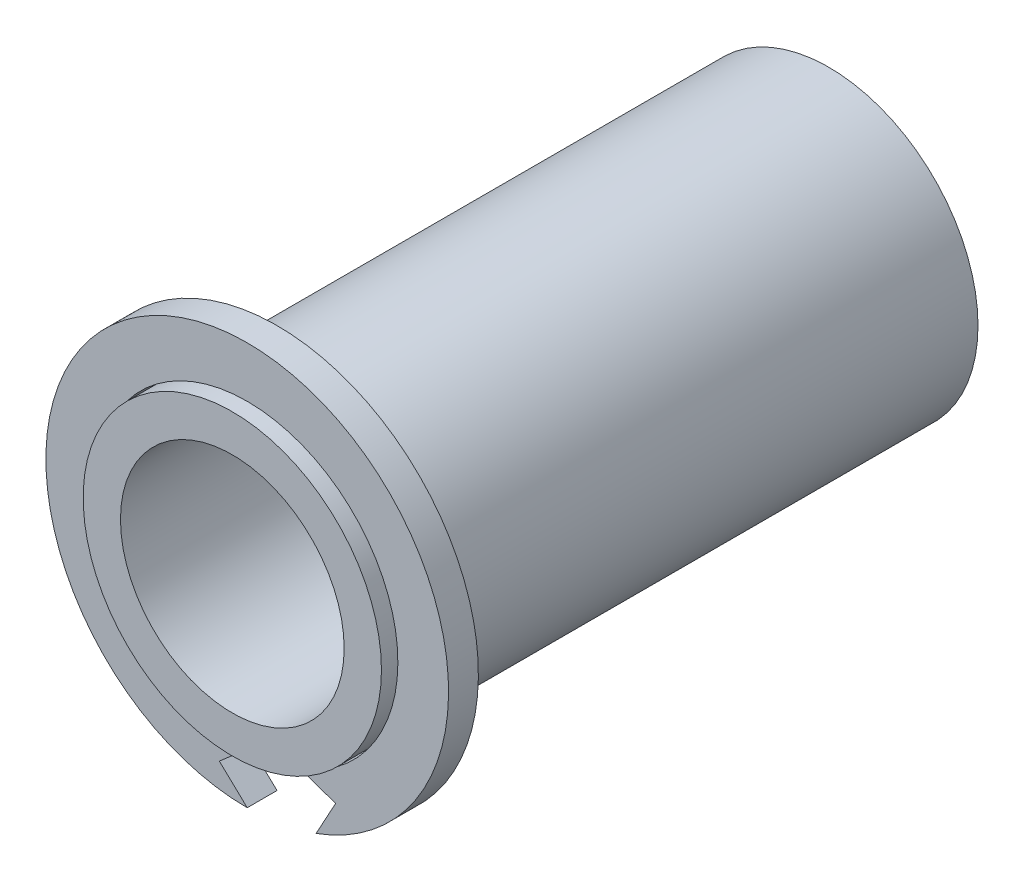
from build123d import *

# Parameters (mm, degrees)
SKETCH_1_R      = 4
SKETCH_1_R_2    = 3
EXTRUDE_1_DEPTH = 16
EXTRUDE_START   = -0.4
EXTRUDE_2_DEPTH = 0.8


with BuildPart() as part:
    # 草图1 → 凸台-拉伸1 (new body)
    with BuildSketch(Plane.XY):
        Circle(SKETCH_1_R)
        Circle(SKETCH_1_R_2, mode=Mode.SUBTRACT)
    extrude(amount=EXTRUDE_1_DEPTH)


with BuildPart() as body_2:
    # 草图2 → 凸台-拉伸2 (new body)
    with BuildSketch(Plane.XY.offset(16).offset(EXTRUDE_START)):
        with BuildLine():
            Line((0, -5.4), (-0.747466557, -4.690820157))
            ThreePointArc((-0.747466557, -4.690820157), (-3.083182922, 3.613375579), (4.75, 0))
            ThreePointArc((4.75, 0), (4.112111247, -2.377612477), (2.369772172, -4.11663453))
            Line((2.369772172, -4.11663453), (1.846908774, -5.074340152))
            ThreePointArc((1.846908774, -5.074340152), (4.423421039, -3.097312756), (5.4, 0))
            ThreePointArc((5.4, 0), (-3.818376618, 3.818376618), (0, -5.4))
        make_face()
        with BuildLine():
            Line((-0.747466557, -4.690820157), (0, -4.040519826))
            ThreePointArc((0, -4.040519826), (-2.857078969, 2.857078969), (4.040519826, 0))
            ThreePointArc((4.040519826, 0), (3.323656961, -2.297630273), (1.427437799, -3.779976428))
            Line((1.427437799, -3.779976428), (2.369772172, -4.11663453))
            ThreePointArc((2.369772172, -4.11663453), (4.112111247, -2.377612477), (4.75, 0))
            ThreePointArc((4.75, 0), (-3.083182922, 3.613375579), (-0.747466557, -4.690820157))
        make_face()
    extrude(amount=-EXTRUDE_2_DEPTH)


solid = Compound([part.part, body_2.part])
